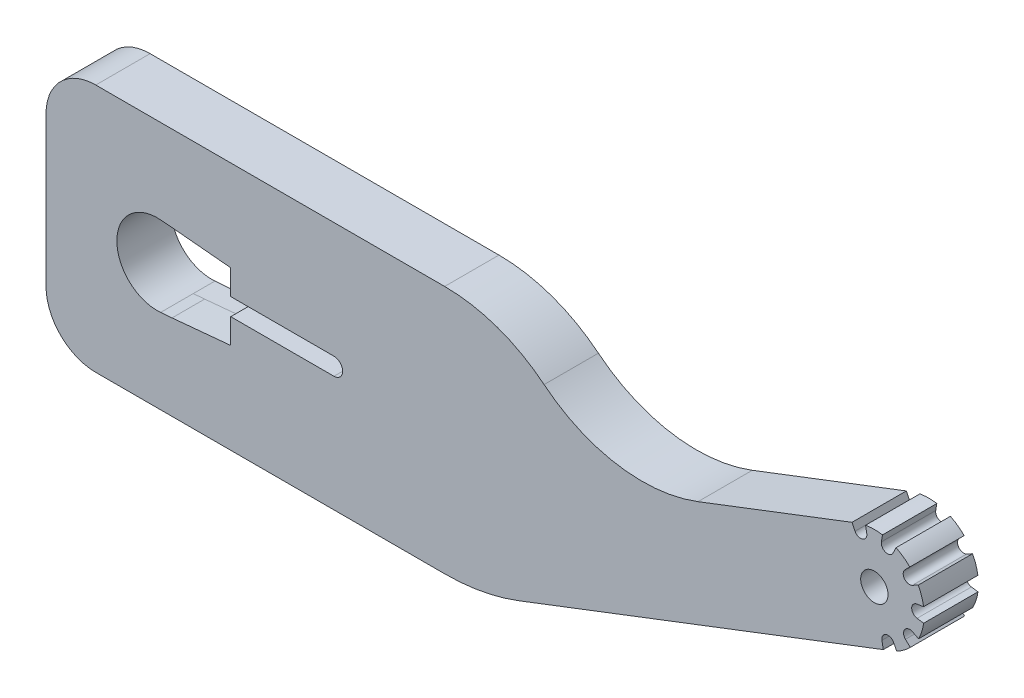
from build123d import *
from build123d.topology import SkipClean

# Parameters (mm, degrees)
CROQUIS1_R              = 1.717841821
CROQUIS1_R_2            = 1.259750669
CROQUIS1_W              = 27.485469141
CROQUIS1_H              = 14.887962451
SALIENTE_EXTRUIR1_DEPTH = 5
SALIENTE_EXTRUIR2_START = -5
SALIENTE_EXTRUIR2_DEPTH = 5
CORTAR_EXTRUIR1_DEPTH   = 5
CORTAR_EXTRUIR2_DEPTH   = 2
CUT_EXTRUDE2_DEPTH      = 83.704538261
CUT_EXTRUDE5_DEPTH      = 83.704538261


with BuildPart() as part:
    # Croquis1 → Saliente-Extruir1 (new body)
    with BuildSketch(Plane(origin=(0, 0, -2.5), x_dir=(-1, 0, 0), z_dir=(0, 0, -1))):
        with BuildLine():
            Line((2.183126414, 10.199004786), (2.457799007, 10.747834714))
            ThreePointArc((2.457799007, 10.747834714), (3.150356623, 11.03498533), (3.533498829, 10.390552574))
            Line((3.533498829, 10.390552574), (3.410556906, 9.704532228))
            Line((3.410556906, 9.704532228), (36.957948904, -3.17310503))
            ThreePointArc((36.957948904, -3.17310503), (40.309989238, -4.118478177), (43.778179918, -4.437160132))
            Line((43.778179918, -4.437160132), (75.884737747, -4.437160132))
            ThreePointArc((75.884737747, -4.437160132), (79.123931349, -3.095442211), (80.46564927, 0.143751392))
            Line((80.46564927, 0.143751392), (80.46564927, 13.886485962))
            ThreePointArc((80.46564927, 13.886485962), (79.123931349, 17.125679564), (75.884737747, 18.467397485))
            Line((75.884737747, 18.467397485), (43.778179918, 18.467397485))
            ThreePointArc((43.778179918, 18.467397485), (38.923372817, 17.631925595), (34.62713443, 15.221634951))
            ThreePointArc((34.62713443, 15.221634951), (27.84817952, 12.197288027), (20.46564927, 12.971336544))
            Line((20.46564927, 12.971336544), (6.293279019, 18.411599775))
            Line((6.293279019, 18.411599775), (6.008822105, 17.843219559))
            ThreePointArc((6.008822105, 17.843219559), (5.316264489, 17.556068943), (4.933122282, 18.200501699))
            Line((4.933122282, 18.200501699), (5.041383533, 18.804603367))
            ThreePointArc((5.041383533, 18.804603367), (4.263160644, 18.876341405), (3.484068945, 18.814751339))
            Line((3.484068945, 18.814751339), (3.584448287, 18.209290101))
            ThreePointArc((3.584448287, 18.209290101), (3.192940304, 17.56990522), (2.504183677, 17.866056933))
            Line((2.504183677, 17.866056933), (2.236686818, 18.418419815))
            ThreePointArc((2.236686818, 18.418419815), (1.564924714, 18.019029169), (0.970828021, 17.511263148))
            Line((0.970828021, 17.511263148), (1.407917802, 17.080436215))
            ThreePointArc((1.407917802, 17.080436215), (1.467002194, 16.333040361), (0.735712768, 16.167791142))
            Line((0.735712768, 16.167791142), (0.194632507, 16.457431391))
            ThreePointArc((0.194632507, 16.457431391), (-0.114078519, 15.739465714), (-0.296255461, 14.9794731))
            Line((-0.296255461, 14.9794731), (0.310591317, 14.887841716))
            ThreePointArc((0.310591317, 14.887841716), (0.797699855, 14.317914702), (0.303205335, 13.754384137))
            Line((0.303205335, 13.754384137), (-0.304784058, 13.670669023))
            ThreePointArc((-0.304784058, 13.670669023), (-0.132526888, 12.9083668), (0.16680132, 12.18643894))
            Line((0.16680132, 12.18643894), (0.711610253, 12.469003179))
            ThreePointArc((0.711610253, 12.469003179), (1.440684032, 12.294237755), (1.371864517, 11.547675365))
            Line((1.371864517, 11.547675365), (0.929197275, 11.122581216))
            ThreePointArc((0.929197275, 11.122581216), (1.516626257, 10.607115987), (2.183126414, 10.199004786))
        make_face()
        with Locations(Location((46.05155145, 7.015118677, 0), (0, 0, 180))):
            Circle(CROQUIS1_R, mode=Mode.SUBTRACT)
        with Locations(Location((77.659840962, 7.015118677, 0), (0, 0, 180))):
            Circle(CROQUIS1_R, mode=Mode.SUBTRACT)
        with Locations(Location((4.233310556, 14.295527136, 0), (0, 0, 180))):
            Circle(CROQUIS1_R_2, mode=Mode.SUBTRACT)
        with Locations((61.855696206, 7.015118677)):
            Rectangle(CROQUIS1_W, CROQUIS1_H, mode=Mode.SUBTRACT)
    extrude(amount=-SALIENTE_EXTRUIR1_DEPTH)

    # Croquis2 → Saliente-Extruir2 (add)
    with BuildSketch(Plane.XY.offset(2.5).offset(SALIENTE_EXTRUIR2_START)):
        with BuildLine():
            Line((-43.778179918, -4.437160132), (-75.884737747, -4.437160132))
            ThreePointArc((-75.884737747, -4.437160132), (-79.123931349, -3.095442211), (-80.46564927, 0.143751392))
            Line((-80.46564927, 0.143751392), (-80.46564927, 13.886485962))
            ThreePointArc((-80.46564927, 13.886485962), (-79.123931349, 17.125679564), (-75.884737747, 18.467397485))
            Line((-75.884737747, 18.467397485), (-43.778179918, 18.467397485))
            Line((-43.778179918, 18.467397485), (-43.778179918, -4.437160132))
        make_face()
    extrude(amount=SALIENTE_EXTRUIR2_DEPTH)

    # Croquis3 → Cortar-Extruir1 (cut)
    with BuildSketch(Plane.XY.offset(2.5)):
        with BuildLine():
            Line((-68.86564927, 10.615118677), (-63.46564927, 10.110118677))
            Line((-63.46564927, 10.110118677), (-63.46564927, 3.920118677))
            Line((-63.46564927, 3.920118677), (-68.86564927, 3.415118677))
            ThreePointArc((-68.86564927, 3.415118677), (-72.46564927, 7.015118677), (-68.86564927, 10.615118677))
        make_face()
    extrude(amount=-CORTAR_EXTRUIR1_DEPTH, mode=Mode.SUBTRACT)

    # Croquis4 → Cortar-Extruir2 (cut)
    with BuildSketch(Plane.XY.offset(2.5)):
        with BuildLine():
            Line((-54.77859891, 9.608381518), (-69.913267682, 10.700035319))
            ThreePointArc((-69.913267682, 10.700035319), (-73.947018097, 7.015118677), (-69.913267682, 3.330202034))
            Line((-69.913267682, 3.330202034), (-54.77859891, 4.421855836))
            ThreePointArc((-54.77859891, 4.421855836), (-52.36564927, 7.015118677), (-54.77859891, 9.608381518))
        make_face()
    extrude(amount=-CORTAR_EXTRUIR2_DEPTH, mode=Mode.SUBTRACT)

    # Sketch2 → Cut-Extrude2 (cut, through all)
    with SkipClean():  # the faces are left unmerged after this step: merging them gives an invalid solid
        with BuildSketch(Plane.XY.offset(0.5)):
            with BuildLine():
                Line((-69.913267682, 10.700035319), (-68.86564927, 10.615118677))
                ThreePointArc((-68.86564927, 10.615118677), (-72.46564927, 7.015118677), (-68.86564927, 3.415118677))
                Line((-68.86564927, 3.415118677), (-69.913267682, 3.330202034))
                ThreePointArc((-69.913267682, 3.330202034), (-73.947018097, 7.015118677), (-69.913267682, 10.700035319))
            make_face()
        extrude(amount=-CUT_EXTRUDE2_DEPTH, mode=Mode.SUBTRACT)

    # Sketch5 → Cut-Extrude5 (cut, through all)
    with SkipClean():  # the faces are left unmerged after this step: merging them gives an invalid solid
        with BuildSketch(Plane.XY.offset(0.5)):
            with BuildLine():
                Line((-63.46564927, 7.815118677), (-53.96564927, 7.815118677))
                ThreePointArc((-53.96564927, 7.815118677), (-53.16564927, 7.015118677), (-53.96564927, 6.215118677))
                Line((-53.96564927, 6.215118677), (-63.46564927, 6.215118677))
                Line((-63.46564927, 6.215118677), (-63.46564927, 7.815118677))
            make_face()
        extrude(amount=-CUT_EXTRUDE5_DEPTH, mode=Mode.SUBTRACT)


with BuildPart() as body_2:
    # Mirror1: mirrored copy
    add(part.part.mirror(Plane(origin=(-4.233310556, 14.295527136, -2.5), x_dir=(1, 0, 0), z_dir=(0, 0, -1))))


solid = body_2.part
